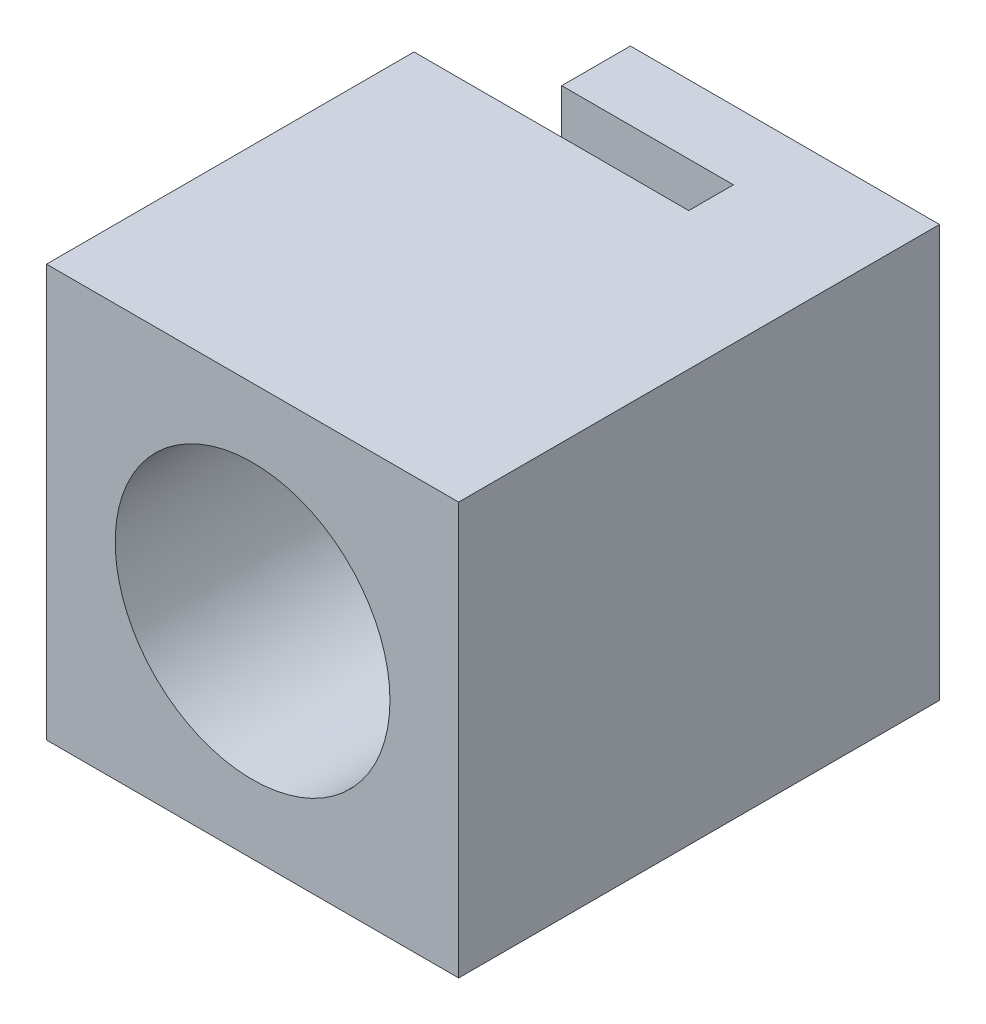
from build123d import *

# Parameters (mm, degrees)
ESQUISSE1_W             = 12
ESQUISSE1_H             = 12
BOSS_EXTRU_1_DEPTH      = 14
ESQUISSE2_R             = 4
ENL_V_MAT_EXTRU_1_DEPTH = 6
ESQUISSE3_W             = 1.3
ESQUISSE3_H             = 14.296544168
ENL_V_MAT_EXTRU_2_DEPTH = 18
ESQUISSE6_W             = 2.656896507
ESQUISSE6_H             = 12.791812985
ENL_V_MAT_EXTRU_4_DEPTH = 13


with BuildPart() as part:
    # Esquisse1 → Boss.-Extru.1 (new body)
    with BuildSketch(Plane.XY):
        Rectangle(ESQUISSE1_W, ESQUISSE1_H)
    extrude(amount=BOSS_EXTRU_1_DEPTH)

    # Esquisse2 → Enlèv. mat.-Extru.1 (cut)
    with BuildSketch(Plane.XY.offset(14)):
        Circle(ESQUISSE2_R)
    extrude(amount=-ENL_V_MAT_EXTRU_1_DEPTH, mode=Mode.SUBTRACT)

    # Esquisse3 → Enlèv. mat.-Extru.2 (cut)
    with BuildSketch(Plane.ZY.offset(16)):
        with Locations((2.65, 0)):
            Rectangle(ESQUISSE3_W, ESQUISSE3_H)
    extrude(amount=-ENL_V_MAT_EXTRU_2_DEPTH, mode=Mode.SUBTRACT)

    # Esquisse6 → Enlèv. mat.-Extru.4 (cut)
    with BuildSketch(Plane.ZY.offset(16)):
        with Locations((0.90678419, -0.070381364)):
            Rectangle(ESQUISSE6_W, ESQUISSE6_H)
    extrude(amount=-ENL_V_MAT_EXTRU_4_DEPTH, mode=Mode.SUBTRACT)


solid = part.part
